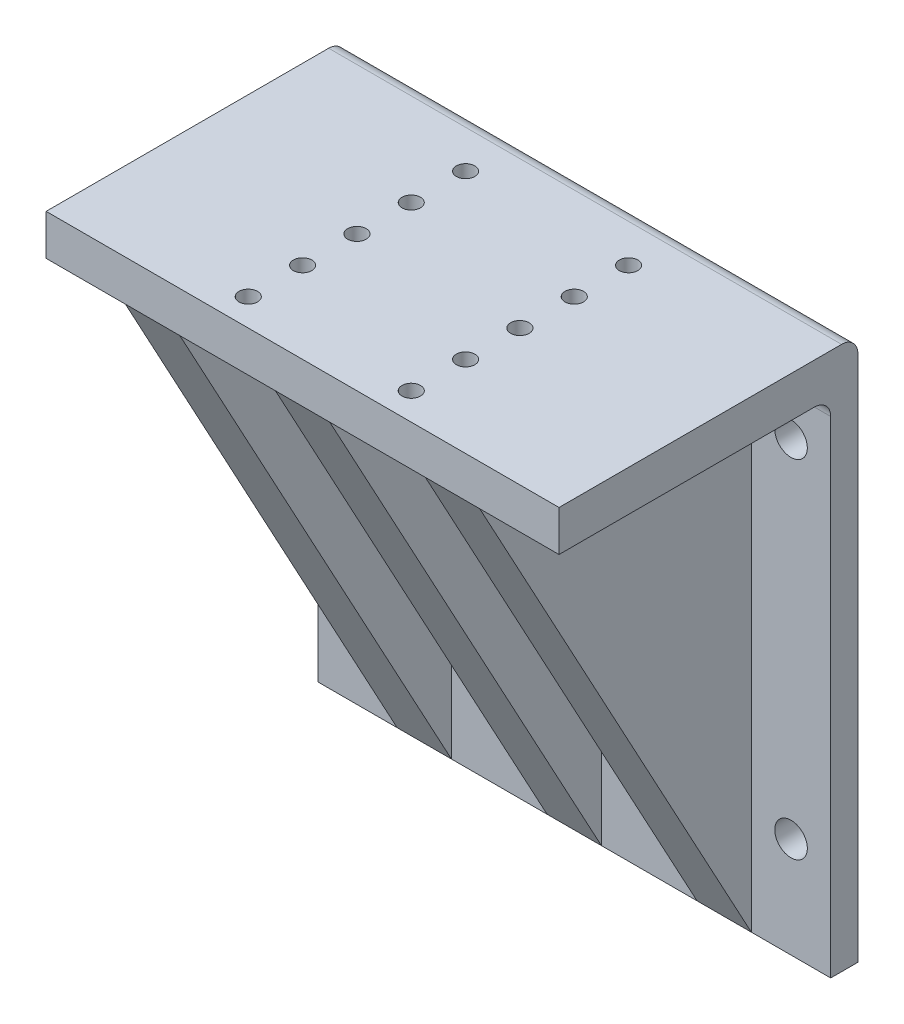
from build123d import *

# Parameters (mm, degrees)
SKETCH1_W           = 2.4
SKETCH1_H           = 100
SKETCH1_W_2         = 92
SKETCH1_R           = 3
BOSS_EXTRUDE1_DEPTH = 5
SKETCH2_W           = 94.4
SKETCH2_H           = 7.5
BOSS_EXTRUDE2_DEPTH = 50
BOSS_EXTRUDE3_DEPTH = 5
LPATTERN1_COUNT     = 2
LPATTERN1_PITCH     = 27.6
LPATTERN1_COL_COUNT = 2
LPATTERN1_COL_PITCH = 27.6
FILLET1_R           = 3
CUT_EXTRUDE2_REACH  = 145.152
SKETCH9_R           = 1.7


with BuildPart() as part:
    # Sketch1 → Boss-Extrude1 (new body)
    # profile 1 of 2: a face of its own
    with BuildSketch(Plane.XY):
        with Locations((93.2, 50)):
            Rectangle(SKETCH1_W, SKETCH1_H)
    # profile 2 of 2: a face of its own
    with BuildSketch(Plane.XY):
        with Locations((46, 50)):
            Rectangle(SKETCH1_W_2, SKETCH1_H)
        with Locations((7.3, 20.94)):
            Circle(SKETCH1_R, mode=Mode.SUBTRACT)
        with Locations((87.1, 18.5)):
            Circle(SKETCH1_R, mode=Mode.SUBTRACT)
        with Locations((7.3, 66.66)):
            Circle(SKETCH1_R, mode=Mode.SUBTRACT)
        with Locations((87.1, 82.32)):
            Circle(SKETCH1_R, mode=Mode.SUBTRACT)
    extrude(amount=BOSS_EXTRUDE1_DEPTH)

    # Sketch2 → Boss-Extrude2 (add)
    with BuildSketch(Plane.XY.offset(5)):
        with Locations((47.2, 96.25)):
            Rectangle(SKETCH2_W, SKETCH2_H)
    extrude(amount=BOSS_EXTRUDE2_DEPTH)

    # Sketch7 → Boss-Extrude3 (add, symmetric)
    with BuildSketch(Plane(origin=(47.2, 0, 0), x_dir=(0, 0, -1), z_dir=(1, 0, 0))):
        Polygon((-55, 92.5), (-5, 0), (-5, 92.5), align=None)
    boss_extrude3 = extrude(amount=BOSS_EXTRUDE3_DEPTH, both=True)

    # LPattern1: Boss-Extrude3 ×2
    with Locations(*[(-i * LPATTERN1_PITCH, 0, 0) for i in range(1, LPATTERN1_COUNT)]):
        add(boss_extrude3)

    # LPattern1 col: Boss-Extrude3 ×2
    with Locations(*[(i * LPATTERN1_COL_PITCH, 0, 0) for i in range(1, LPATTERN1_COL_COUNT)]):
        add(boss_extrude3)

    # Fillet1
    fillet1_edges = [part.edges().sort_by_distance(p)[0] for p in [
        (47.2, 100, 0),
        (7.3, 92.5, 5),
        (61, 92.5, 5),
        (87.1, 92.5, 5),
        (33.4, 92.5, 5),
    ]]
    fillet(fillet1_edges, radius=FILLET1_R)

    # Sketch9 → Cut-Extrude2 (cut, up to next)
    with BuildSketch(Plane.XZ.offset(-92.5), mode=Mode.PRIVATE) as cut_extrude2_sk1:
        with Locations(Location((32.2, 50, 0), (0, 0, 270))):
            Circle(SKETCH9_R)
    cut_extrude2_tool1 = extrude(cut_extrude2_sk1.sketch, amount=-CUT_EXTRUDE2_REACH, mode=Mode.PRIVATE) & part.part
    # Sketch9 → Cut-Extrude2 (cut, up to next)
    with BuildSketch(Plane.XZ.offset(-92.5), mode=Mode.PRIVATE) as cut_extrude2_sk2:
        with Locations(Location((62.2, 50, 0), (0, 0, 270))):
            Circle(SKETCH9_R)
    cut_extrude2_tool2 = extrude(cut_extrude2_sk2.sketch, amount=-CUT_EXTRUDE2_REACH, mode=Mode.PRIVATE) & part.part
    # Sketch9 → Cut-Extrude2 (cut, up to next)
    with BuildSketch(Plane.XZ.offset(-92.5), mode=Mode.PRIVATE) as cut_extrude2_sk3:
        with Locations(Location((62.2, 40, 0), (0, 0, 270))):
            Circle(SKETCH9_R)
    cut_extrude2_tool3 = extrude(cut_extrude2_sk3.sketch, amount=-CUT_EXTRUDE2_REACH, mode=Mode.PRIVATE) & part.part
    # Sketch9 → Cut-Extrude2 (cut, up to next)
    with BuildSketch(Plane.XZ.offset(-92.5), mode=Mode.PRIVATE) as cut_extrude2_sk4:
        with Locations(Location((62.2, 30, 0), (0, 0, 270))):
            Circle(SKETCH9_R)
    cut_extrude2_tool4 = extrude(cut_extrude2_sk4.sketch, amount=-CUT_EXTRUDE2_REACH, mode=Mode.PRIVATE) & part.part
    # Sketch9 → Cut-Extrude2 (cut, up to next)
    with BuildSketch(Plane.XZ.offset(-92.5), mode=Mode.PRIVATE) as cut_extrude2_sk5:
        with Locations(Location((62.2, 20, 0), (0, 0, 270))):
            Circle(SKETCH9_R)
    cut_extrude2_tool5 = extrude(cut_extrude2_sk5.sketch, amount=-CUT_EXTRUDE2_REACH, mode=Mode.PRIVATE) & part.part
    # Sketch9 → Cut-Extrude2 (cut, up to next)
    with BuildSketch(Plane.XZ.offset(-92.5), mode=Mode.PRIVATE) as cut_extrude2_sk6:
        with Locations(Location((62.2, 10, 0), (0, 0, 270))):
            Circle(SKETCH9_R)
    cut_extrude2_tool6 = extrude(cut_extrude2_sk6.sketch, amount=-CUT_EXTRUDE2_REACH, mode=Mode.PRIVATE) & part.part
    # Sketch9 → Cut-Extrude2 (cut, up to next)
    with BuildSketch(Plane.XZ.offset(-92.5), mode=Mode.PRIVATE) as cut_extrude2_sk7:
        with Locations(Location((32.2, 40, 0), (0, 0, 270))):
            Circle(SKETCH9_R)
    cut_extrude2_tool7 = extrude(cut_extrude2_sk7.sketch, amount=-CUT_EXTRUDE2_REACH, mode=Mode.PRIVATE) & part.part
    # Sketch9 → Cut-Extrude2 (cut, up to next)
    with BuildSketch(Plane.XZ.offset(-92.5), mode=Mode.PRIVATE) as cut_extrude2_sk8:
        with Locations(Location((32.2, 30, 0), (0, 0, 270))):
            Circle(SKETCH9_R)
    cut_extrude2_tool8 = extrude(cut_extrude2_sk8.sketch, amount=-CUT_EXTRUDE2_REACH, mode=Mode.PRIVATE) & part.part
    # Sketch9 → Cut-Extrude2 (cut, up to next)
    with BuildSketch(Plane.XZ.offset(-92.5), mode=Mode.PRIVATE) as cut_extrude2_sk9:
        with Locations(Location((32.2, 20, 0), (0, 0, 270))):
            Circle(SKETCH9_R)
    cut_extrude2_tool9 = extrude(cut_extrude2_sk9.sketch, amount=-CUT_EXTRUDE2_REACH, mode=Mode.PRIVATE) & part.part
    # Sketch9 → Cut-Extrude2 (cut, up to next)
    with BuildSketch(Plane.XZ.offset(-92.5), mode=Mode.PRIVATE) as cut_extrude2_sk10:
        with Locations(Location((32.2, 10, 0), (0, 0, 270))):
            Circle(SKETCH9_R)
    cut_extrude2_tool10 = extrude(cut_extrude2_sk10.sketch, amount=-CUT_EXTRUDE2_REACH, mode=Mode.PRIVATE) & part.part
    add(cut_extrude2_tool1.solids().sort_by_distance((32.2, 92.5, 50))[0], mode=Mode.SUBTRACT)
    add(cut_extrude2_tool2.solids().sort_by_distance((62.2, 92.5, 50))[0], mode=Mode.SUBTRACT)
    add(cut_extrude2_tool3.solids().sort_by_distance((62.2, 92.5, 40))[0], mode=Mode.SUBTRACT)
    add(cut_extrude2_tool4.solids().sort_by_distance((62.2, 92.5, 30))[0], mode=Mode.SUBTRACT)
    add(cut_extrude2_tool5.solids().sort_by_distance((62.2, 92.5, 20))[0], mode=Mode.SUBTRACT)
    add(cut_extrude2_tool6.solids().sort_by_distance((62.2, 92.5, 10))[0], mode=Mode.SUBTRACT)
    add(cut_extrude2_tool7.solids().sort_by_distance((32.2, 92.5, 40))[0], mode=Mode.SUBTRACT)
    add(cut_extrude2_tool8.solids().sort_by_distance((32.2, 92.5, 30))[0], mode=Mode.SUBTRACT)
    add(cut_extrude2_tool9.solids().sort_by_distance((32.2, 92.5, 20))[0], mode=Mode.SUBTRACT)
    add(cut_extrude2_tool10.solids().sort_by_distance((32.2, 92.5, 10))[0], mode=Mode.SUBTRACT)


solid = part.part
